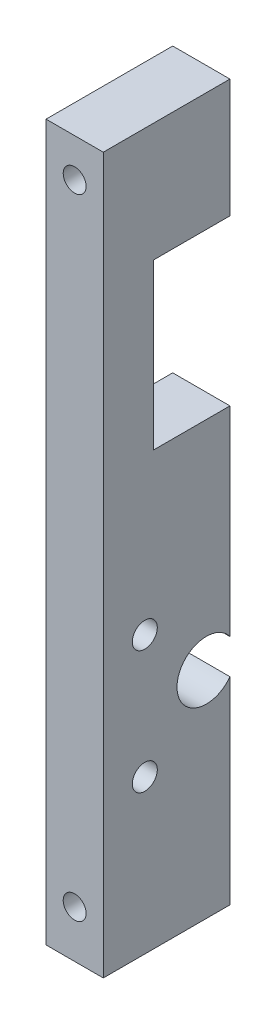
from build123d import *

# Parameters (mm, degrees)
SKETCH_1_W                      = 4
SKETCH_1_H                      = 49.98
RIGHT_RF_PLATE_DEPTH            = 8.851909566
SKETCH_2_R                      = 0.8
FRAME_2XD1P6_THROUGH_DEPTH      = 72.016485431
SKETCH_3_R                      = 2.05
SMA_CENTER_D4P1_DEPTH           = 4
SKETCH_4_R                      = 0.875
SMA_UPPER_2XD1P75_THROUGH_DEPTH = 48.179152176
SKETCH_5_W                      = 6.7
SKETCH_5_H                      = 11.5
TYPEC_WINDOW_11P5X6P7_DEPTH     = 4


with BuildPart() as part:
    # 草图1 → Right_RF_Plate (new body)
    with BuildSketch(Plane.XY):
        with Locations((51.65, 20.69)):
            Rectangle(SKETCH_1_W, SKETCH_1_H)
    extrude(amount=RIGHT_RF_PLATE_DEPTH)


with BuildPart() as part_1:
    # Stock_Z_Position: moved
    add(part.part.moved(Location((0, 0, 2.248090434))))

    # 草图2 → Frame_2xD1p6_Through (cut, through all)
    with BuildSketch(Plane.XY.offset(11.1)):
        with Locations((51.65, -1)):
            Circle(SKETCH_2_R)
        with Locations((51.65, 43)):
            Circle(SKETCH_2_R)
    extrude(amount=-FRAME_2XD1P6_THROUGH_DEPTH, mode=Mode.SUBTRACT)

    # 草图3 → SMA_Center_D4p1 (cut)
    with BuildSketch(Plane(origin=(53.65, 0, 0), x_dir=(0, 0, -1), z_dir=(1, 0, 0))):
        with Locations((-3.899496327, 10.725)):
            Circle(SKETCH_3_R)
    extrude(amount=-SMA_CENTER_D4P1_DEPTH, mode=Mode.SUBTRACT)

    # 草图4 → SMA_Upper_2xD1p75_Through (cut, through all)
    with BuildSketch(Plane(origin=(53.65, 0, 0), x_dir=(0, 0, -1), z_dir=(1, 0, 0))):
        with Locations((-8.199496327, 6.425)):
            Circle(SKETCH_4_R)
        with Locations((-8.199496327, 15.025)):
            Circle(SKETCH_4_R)
    extrude(amount=-SMA_UPPER_2XD1P75_THROUGH_DEPTH, mode=Mode.SUBTRACT)

    # 草图5 → TypeC_Window_11p5x6p7 (cut)
    with BuildSketch(Plane(origin=(53.65, 0, 0), x_dir=(0, 0, -1), z_dir=(1, 0, 0))):
        with Locations((-4.25, 31.65)):
            Rectangle(SKETCH_5_W, SKETCH_5_H)
    extrude(amount=-TYPEC_WINDOW_11P5X6P7_DEPTH, mode=Mode.SUBTRACT)


solid = part_1.part
